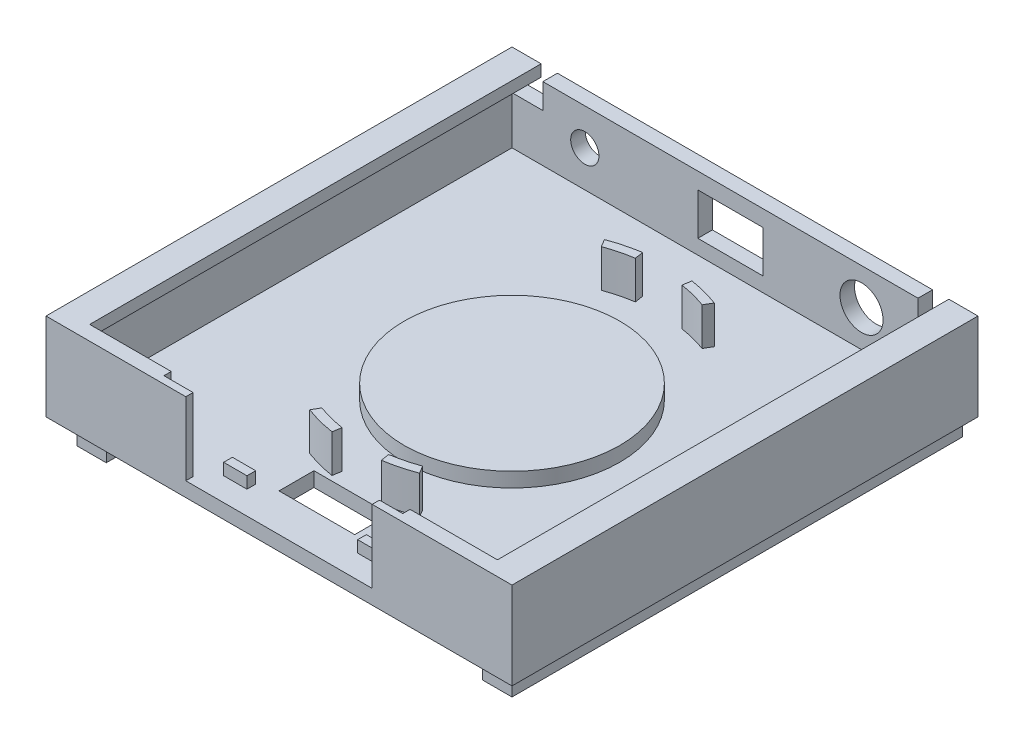
from build123d import *

# Parameters (mm, degrees)
SKETCH1_W           = 80
SKETCH1_H           = 80
BOSS_EXTRUDE1_DEPTH = 2.5
SKETCH3_W           = 80
SKETCH3_H           = 80
SKETCH3_W_2         = 75
SKETCH3_H_2         = 75
BOSS_EXTRUDE2_DEPTH = 12.5
BOSS_EXTRUDE3_DEPTH = 6.5
SKETCH5_W           = 13
SKETCH5_H           = 6
CUT_EXTRUDE1_DEPTH  = 58.933151131
CUT_EXTRUDE2_REACH  = 92.692
SKETCH6_W           = 32
SKETCH6_H           = 12.5
CUT_EXTRUDE3_REACH  = 92.692
SKETCH7_W           = 11.2
SKETCH7_H           = 7.2
BOSS_EXTRUDE4_DEPTH = 77.35
CUT_EXTRUDE4_REACH  = 92.692
BOSS_EXTRUDE5_REACH = 90.494
SKETCH15_W          = 2.5
SKETCH15_H          = 2
BOSS_EXTRUDE6_DEPTH = 2.5
SKETCH16_W          = 5
SKETCH16_H          = 12.5
SKETCH16_W_2        = 4
CUT_EXTRUDE5_DEPTH  = 1.25
SKETCH17_W          = 4
SKETCH17_H          = 1.5
BOSS_EXTRUDE7_DEPTH = 2
CUT_EXTRUDE7_REACH  = 92.692
SKETCH18_R          = 3.7
CUT_EXTRUDE8_REACH  = 92.692
SKETCH19_R          = 2.425


with BuildPart() as part:
    # Sketch1 → Boss-Extrude1 (new body)
    with BuildSketch(Plane(origin=(0, 0, 0), x_dir=(1, 0, 0), z_dir=(0, 1, 0))):
        Rectangle(SKETCH1_W, SKETCH1_H)
    extrude(amount=BOSS_EXTRUDE1_DEPTH)

    # Sketch3 → Boss-Extrude2 (add)
    with BuildSketch(Plane(origin=(0, 2.5, 0), x_dir=(1, 0, 0), z_dir=(0, 1, 0))):
        Rectangle(SKETCH3_W, SKETCH3_H)
        Rectangle(SKETCH3_W_2, SKETCH3_H_2, mode=Mode.SUBTRACT)
    extrude(amount=BOSS_EXTRUDE2_DEPTH)

    # Sketch2 → Boss-Extrude3 (add)
    with BuildSketch(Plane(origin=(0, 2.5, 0), x_dir=(1, 0, 0), z_dir=(0, 1, 0))):
        with BuildLine():
            ThreePointArc((-8.653956432, 23.98664291), (-6.354755269, 24.695487148), (-3.998981529, 25.184482261))
            Line((-3.998981529, 25.184482261), (-4.234215736, 26.665922394))
            ThreePointArc((-4.234215736, 26.665922394), (-6.862755968, 26.113264455), (-9.423377938, 25.302172797))
            Line((-9.423377938, 25.302172797), (-8.653956432, 23.98664291))
        make_face()
        with BuildLine():
            Line((4.234215736, 26.665922394), (3.998981529, 25.184482261))
            ThreePointArc((3.998981529, 25.184482261), (6.354755269, 24.695487148), (8.653956432, 23.98664291))
            Line((8.653956432, 23.98664291), (9.423377938, 25.302172797))
            ThreePointArc((9.423377938, 25.302172797), (6.862755968, 26.113264455), (4.234215736, 26.665922394))
        make_face()
        with BuildLine():
            Line((-8.653956432, -23.98664291), (-9.423377938, -25.302172797))
            ThreePointArc((-9.423377938, -25.302172797), (-6.862755968, -26.113264455), (-4.234215736, -26.665922394))
            Line((-4.234215736, -26.665922394), (-3.998981529, -25.184482261))
            ThreePointArc((-3.998981529, -25.184482261), (-6.354755269, -24.695487148), (-8.653956432, -23.98664291))
        make_face()
        with BuildLine():
            Line((9.423377938, -25.302172797), (8.653956432, -23.98664291))
            ThreePointArc((8.653956432, -23.98664291), (6.354755269, -24.695487148), (3.998981529, -25.184482261))
            Line((3.998981529, -25.184482261), (4.234215736, -26.665922394))
            ThreePointArc((4.234215736, -26.665922394), (6.862755968, -26.113264455), (9.423377938, -25.302172797))
        make_face()
    extrude(amount=BOSS_EXTRUDE3_DEPTH)

    # Sketch5 → Cut-Extrude1 (cut, through all)
    with BuildSketch(Plane(origin=(0, 2.5, 0), x_dir=(1, 0, 0), z_dir=(0, 1, 0))):
        with Locations((0, -30.5)):
            Rectangle(SKETCH5_W, SKETCH5_H)
    extrude(amount=-CUT_EXTRUDE1_DEPTH, mode=Mode.SUBTRACT)

    # Sketch6 → Cut-Extrude2 (cut, up to next)
    with BuildSketch(Plane.XY.offset(40), mode=Mode.PRIVATE) as cut_extrude2_sk1:
        with Locations((0, 8.75)):
            Rectangle(SKETCH6_W, SKETCH6_H)
    cut_extrude2_tool1 = extrude(cut_extrude2_sk1.sketch, amount=-CUT_EXTRUDE2_REACH, mode=Mode.PRIVATE) & part.part
    add(cut_extrude2_tool1.solids().sort_by_distance((0, 8.75, 40))[0], mode=Mode.SUBTRACT)

    # Sketch7 → Cut-Extrude3 (cut, up to next)
    with BuildSketch(Plane(origin=(0, 0, -40), x_dir=(-1, 0, 0), z_dir=(0, 0, -1)), mode=Mode.PRIVATE) as cut_extrude3_sk1:
        with Locations((0, 8.6)):
            Rectangle(SKETCH7_W, SKETCH7_H)
    cut_extrude3_tool1 = extrude(cut_extrude3_sk1.sketch, amount=-CUT_EXTRUDE3_REACH, mode=Mode.PRIVATE) & part.part
    add(cut_extrude3_tool1.solids().sort_by_distance((0, 8.6, -40))[0], mode=Mode.SUBTRACT)

    # Sketch9 → Boss-Extrude4 (add)
    with BuildSketch(Plane(origin=(0, 0, -40), x_dir=(-1, 0, 0), z_dir=(0, 0, -1))):
        Polygon((34.8, 0), (32.3, 0), (32.3, -4.3), (37.35, -4.3), (37.35, -2.3), (34.8, -2.3), align=None)
        Polygon((-32.3, 0), (-34.8, 0), (-34.8, -2.3), (-37.35, -2.3), (-37.35, -4.3), (-32.3, -4.3), align=None)
    extrude(amount=-BOSS_EXTRUDE4_DEPTH)

    # Sketch10 → Cut-Extrude4 (cut, up to next)
    with BuildSketch(Plane(origin=(0, 0, -40), x_dir=(-1, 0, 0), z_dir=(0, 0, -1)), mode=Mode.PRIVATE) as cut_extrude4_sk1:
        Polygon((-32.2, 15), (-35, 15), (-35, 13), (-37.5, 13), (-37.5, 10.7), (-32.2, 10.7), align=None)
    cut_extrude4_tool1 = extrude(cut_extrude4_sk1.sketch, amount=-CUT_EXTRUDE4_REACH, mode=Mode.PRIVATE) & part.part
    # Sketch10 → Cut-Extrude4 (cut, up to next)
    with BuildSketch(Plane(origin=(0, 0, -40), x_dir=(-1, 0, 0), z_dir=(0, 0, -1)), mode=Mode.PRIVATE) as cut_extrude4_sk2:
        Polygon((35, 15), (32.2, 15), (32.2, 10.7), (37.5, 10.7), (37.5, 13), (35, 13), align=None)
    cut_extrude4_tool2 = extrude(cut_extrude4_sk2.sketch, amount=-CUT_EXTRUDE4_REACH, mode=Mode.PRIVATE) & part.part
    add(cut_extrude4_tool1.solids().sort_by_distance((34.456521, 12.526785, -40))[0], mode=Mode.SUBTRACT)
    add(cut_extrude4_tool2.solids().sort_by_distance((-34.456521, 12.526785, -40))[0], mode=Mode.SUBTRACT)

    # Sketch15 → Boss-Extrude5 (add, up to next)
    with BuildSketch(Plane.XY.offset(-37.5), mode=Mode.PRIVATE) as boss_extrude5_sk1:
        with Locations((36.25, 14)):
            Rectangle(SKETCH15_W, SKETCH15_H)
    boss_extrude5_tool1 = extrude(boss_extrude5_sk1.sketch, amount=BOSS_EXTRUDE5_REACH, mode=Mode.PRIVATE) - part.part
    # Sketch15 → Boss-Extrude5 (add, up to next)
    with BuildSketch(Plane.XY.offset(-37.5), mode=Mode.PRIVATE) as boss_extrude5_sk2:
        with Locations((-36.25, 14)):
            Rectangle(SKETCH15_W, SKETCH15_H)
    boss_extrude5_tool2 = extrude(boss_extrude5_sk2.sketch, amount=BOSS_EXTRUDE5_REACH, mode=Mode.PRIVATE) - part.part
    add(boss_extrude5_tool1.solids().sort_by_distance((36.25, 14, -37.5))[0])
    add(boss_extrude5_tool2.solids().sort_by_distance((-36.25, 14, -37.5))[0])

    # Sketch2<3> → Boss-Extrude6 (add)
    with BuildSketch(Plane(origin=(0, 2.5, 0), x_dir=(1, 0, 0), z_dir=(0, 1, 0))):
        with BuildLine():
            ThreePointArc((18.5, 0), (0, 18.5), (-18.5, 0))
            Line((-18.5, 0), (0, 0))
            Line((0, 0), (0, -18.5))
            ThreePointArc((0, -18.5), (13.081475452, -13.081475452), (18.5, 0))
        make_face()
        with BuildLine():
            Line((0, 0), (-18.5, 0))
            ThreePointArc((-18.5, 0), (-13.081475452, -13.081475452), (0, -18.5))
            Line((0, -18.5), (0, 0))
        make_face()
    extrude(amount=BOSS_EXTRUDE6_DEPTH)

    # Sketch16 → Cut-Extrude5 (cut)
    with BuildSketch(Plane(origin=(0, 0, 37.5), x_dir=(-1, 0, 0), z_dir=(0, 0, -1))):
        with Locations((18.5, 8.75)):
            Rectangle(SKETCH16_W, SKETCH16_H)
        with Locations((-18, 8.75)):
            Rectangle(SKETCH16_W_2, SKETCH16_H)
    extrude(amount=-CUT_EXTRUDE5_DEPTH, mode=Mode.SUBTRACT)

    # Sketch17 → Boss-Extrude7 (add)
    with BuildSketch(Plane(origin=(0, 2.5, 0), x_dir=(1, 0, 0), z_dir=(0, 1, 0))):
        with Locations((-11.5, -35.25)):
            Rectangle(SKETCH17_W, SKETCH17_H)
        with Locations((11.5, -35.25)):
            Rectangle(SKETCH17_W, SKETCH17_H)
    extrude(amount=BOSS_EXTRUDE7_DEPTH)

    # Sketch18 → Cut-Extrude7 (cut, up to next)
    with BuildSketch(Plane(origin=(0, 0, -40), x_dir=(-1, 0, 0), z_dir=(0, 0, -1)), mode=Mode.PRIVATE) as cut_extrude7_sk1:
        with Locations((-22.5, 8.75)):
            Circle(SKETCH18_R)
    cut_extrude7_tool1 = extrude(cut_extrude7_sk1.sketch, amount=-CUT_EXTRUDE7_REACH, mode=Mode.PRIVATE) & part.part
    add(cut_extrude7_tool1.solids().sort_by_distance((22.5, 8.75, -40))[0], mode=Mode.SUBTRACT)

    # Sketch19 → Cut-Extrude8 (cut, up to next)
    with BuildSketch(Plane(origin=(0, 0, -40), x_dir=(-1, 0, 0), z_dir=(0, 0, -1)), mode=Mode.PRIVATE) as cut_extrude8_sk1:
        with Locations((25, 8.75)):
            Circle(SKETCH19_R)
    cut_extrude8_tool1 = extrude(cut_extrude8_sk1.sketch, amount=-CUT_EXTRUDE8_REACH, mode=Mode.PRIVATE) & part.part
    add(cut_extrude8_tool1.solids().sort_by_distance((-25, 8.75, -40))[0], mode=Mode.SUBTRACT)


solid = part.part
